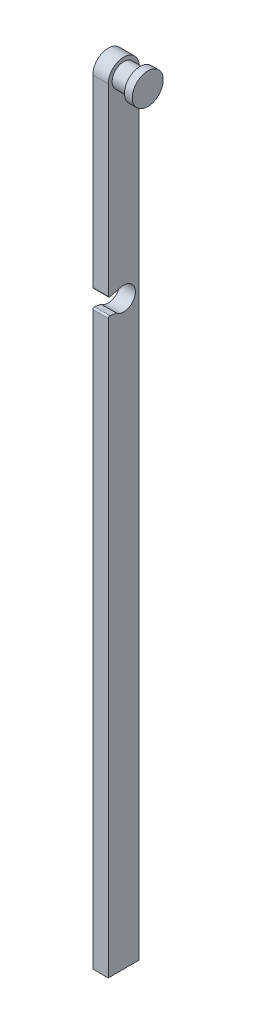
from build123d import *

# Parameters (mm, degrees)
BASE_DEPTH         = 2
ESQUISSE2_R        = 1.5
BOSS_FIX_DEPTH     = 2.1
ESQUISSE3_R        = 2
BOSS_BLOCAGE_DEPTH = 1
VIDE_TIGE_DEPTH    = 2
CONGE_TIGE_R       = 0.2


with BuildPart() as part:
    # Esquisse1 → BASE (new body)
    with BuildSketch(Plane(origin=(0, 0, 0), x_dir=(0, 0, -1), z_dir=(1, 0, 0))):
        with BuildLine():
            Line((2, 50), (2, -50))
            Line((2, -50), (-2, -50))
            Line((-2, -50), (-2, 50))
            ThreePointArc((-2, 50), (0, 52), (2, 50))
        make_face()
    extrude(amount=BASE_DEPTH)

    # Esquisse2 → BOSS FIX (add)
    with BuildSketch(Plane(origin=(2, 0, 0), x_dir=(0, 0, -1), z_dir=(1, 0, 0))):
        with Locations((0, 50)):
            Circle(ESQUISSE2_R)
    extrude(amount=BOSS_FIX_DEPTH)

    # Esquisse3 → BOSS BLOCAGE (add)
    with BuildSketch(Plane(origin=(4.1, 0, 0), x_dir=(0, 0, -1), z_dir=(1, 0, 0))):
        with Locations((0, 50)):
            Circle(ESQUISSE3_R)
    extrude(amount=BOSS_BLOCAGE_DEPTH)

    # Esquisse4 → VIDE TIGE (cut)
    with BuildSketch(Plane.ZY):
        with BuildLine():
            Line((0.225177093, 26.483002116), (2, 26))
            Line((2, 26), (2, 24))
            Line((2, 24), (0.937042571, 23.828696786))
            ThreePointArc((0.937042571, 23.828696786), (-1.448800481, 24.611442197), (0.225177093, 26.483002116))
        make_face()
    extrude(amount=-VIDE_TIGE_DEPTH, mode=Mode.SUBTRACT)

    # CONGE TIGE
    conge_tige_edges = [part.edges().sort_by_distance(p)[0] for p in [
        (1, 24, 2),
        (1, 26, 2),
    ]]
    fillet(conge_tige_edges, radius=CONGE_TIGE_R)


solid = part.part
